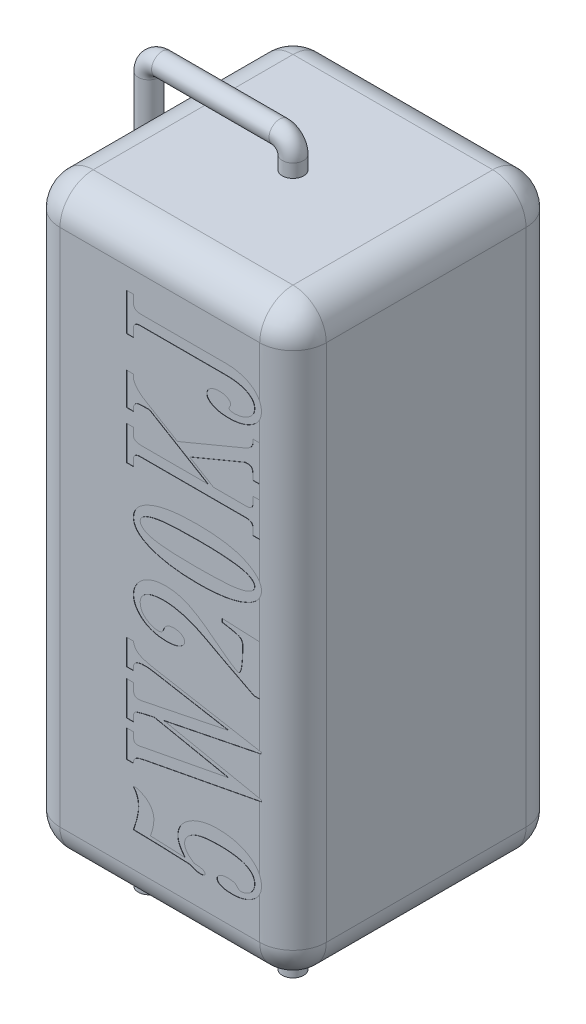
from build123d import *

# Parameters (mm, degrees)
BOSS_EXTRUDE1_DEPTH = 22
FILLET1_R           = 1.25
SKETCH2_R           = 0.4
BOSS_EXTRUDE2_DEPTH = 4
SWEEP2_PROFILE_R    = 0.4
CUT_EXTRUDE1_DEPTH  = 0.01


with BuildPart() as part:
    # Sketch1 → Boss-Extrude1 (new body)
    with BuildSketch(Plane(origin=(0, 0, 0), x_dir=(1, 0, 0), z_dir=(0, 1, 0))):
        with BuildLine():
            Line((-3.75, 5), (3.75, 5))
            ThreePointArc((3.75, 5), (4.633883476, 4.633883476), (5, 3.75))
            Line((5, 3.75), (5, -3.75))
            ThreePointArc((5, -3.75), (4.633883476, -4.633883476), (3.75, -5))
            Line((3.75, -5), (-3.75, -5))
            ThreePointArc((-3.75, -5), (-4.633883476, -4.633883476), (-5, -3.75))
            Line((-5, -3.75), (-5, 3.75))
            ThreePointArc((-5, 3.75), (-4.633883476, 4.633883476), (-3.75, 5))
        make_face()
    extrude(amount=BOSS_EXTRUDE1_DEPTH)

    # Fillet1
    fillet1_edges = [part.edges().sort_by_distance(p)[0] for p in [
        (-5, 0, 0),
        (-4.633883476, 0, -4.633883476),
        (0, 0, -5),
        (4.633883476, 0, -4.633883476),
        (-4.633883476, 22, -4.633883476),
        (-5, 22, 0),
        (-4.633883476, 22, 4.633883476),
        (0, 22, 5),
        (4.633883476, 22, 4.633883476),
        (5, 22, 0),
        (4.633883476, 22, -4.633883476),
        (5, 0, 0),
        (0, 22, -5),
        (4.633883476, 0, 4.633883476),
        (0, 0, 5),
        (-4.633883476, 0, 4.633883476),
    ]]
    fillet(fillet1_edges, radius=FILLET1_R)

    # Sketch2 → Boss-Extrude2 (add)
    with BuildSketch(Plane.XZ):
        with Locations(Location((0, 0, 0), (0, 0, 270))):
            Circle(SKETCH2_R)
    extrude(amount=BOSS_EXTRUDE2_DEPTH)

    # Sweep2: sweep along a path in Sketch3
    with BuildLine(Plane.XY) as sweep2_path:
        Line((0, 22), (0, 22.5))
        ThreePointArc((0, 22.5), (-0.146446609, 22.853553391), (-0.5, 23))
        Line((-0.5, 23), (-4.91, 23))
        ThreePointArc((-4.91, 23), (-5.263553391, 22.853553391), (-5.41, 22.5))
        Line((-5.41, 22.5), (-5.41, -4))
    # Sweep2 profile (on start of the path) → Sweep2 (sweep)
    with BuildSketch(Plane(origin=(0, 22, 0), x_dir=(1, 0, 0), z_dir=(0, 1, 0))):
        Circle(SWEEP2_PROFILE_R)
    sweep(path=sweep2_path.line)

    # Sketch28 → Cut-Extrude1 (cut)
    # profile 1 of 6: a face of its own
    with BuildSketch(Plane.XY.offset(5)):
        with BuildLine():
            add(Edge.make_bspline(
                [(-0.993589744, 2.542467949), (-0.978307234, 2.585114271), (-0.948598002, 2.668018817), (-0.909574789, 2.790296485), (-0.876337133, 2.906500732), (-0.849157251, 3.016729938), (-0.827912027, 3.120966271), (-0.81281788, 3.219223515), (-0.80319514, 3.311506386), (-0.801904352, 3.371106166), (-0.801282051, 3.399839744)],
                knots=[0, 0, 0, 0, 1.231547186, 2.394130472, 3.48882468, 4.516917581, 5.479964155, 6.37985664, 7.218914656, 8, 8, 8, 8], degree=3))
            add(Edge.make_bspline(
                [(-0.801282051, 3.399839744), (-0.803279711, 3.450533912), (-0.80719983, 3.55001388), (-0.840596315, 3.668503859), (-0.873522781, 3.755010231), (-0.901672878, 3.810632084), (-0.930291261, 3.858940951), (-0.952845176, 3.885867534), (-0.963541667, 3.898637821)],
                knots=[0, 0, 0, 0, 1.703203784, 3.34229095, 4.11486405, 4.818852633, 5.439825325, 6, 6, 6, 6], degree=3))
            add(Edge.make_bspline(
                [(-0.963541667, 3.898637821), (-0.971527113, 3.907921778), (-0.983436897, 3.921768208), (-0.991073457, 3.938271886), (-0.993589744, 3.943709936)],
                knots=[0, 0, 0, 0, 1.340989405, 2, 2, 2, 2], degree=3))
            add(Edge.make_bspline(
                [(-0.993589744, 3.943709936), (-0.990038681, 3.949827531), (-0.979858438, 3.967365548), (-0.958451202, 3.965777619), (-0.944511218, 3.96474359)],
                knots=[0, 0, 0, 0, 0.697638205, 2, 2, 2, 2], degree=3))
            add(Edge.make_bspline(
                [(-0.944511218, 3.96474359), (-0.92339519, 3.963334311), (-0.877919315, 3.960299263), (-0.80549498, 3.941839223), (-0.724983857, 3.910842365), (-0.636988641, 3.871270681), (-0.548833917, 3.821660682), (-0.466719566, 3.762983872), (-0.396373672, 3.693510812), (-0.334488512, 3.617728128), (-0.285478149, 3.533590036), (-0.249714387, 3.442852284), (-0.228190869, 3.345755858), (-0.225653021, 3.278755031), (-0.224358974, 3.244591346)],
                knots=[0, 0, 0, 0, 0.681915251, 1.46858554, 2.399324007, 3.464989181, 4.57964638, 5.659436258, 6.71100783, 7.761087771, 8.808953985, 9.839446264, 10.898334831, 12, 12, 12, 12], degree=3))
            add(Edge.make_bspline(
                [(-0.224358974, 3.244591346), (-0.226060808, 3.202091377), (-0.229649101, 3.112480794), (-0.255776537, 2.97278401), (-0.295588341, 2.82132393), (-0.332993779, 2.718473993), (-0.352564103, 2.664663462)],
                knots=[0, 0, 0, 0, 0.854149321, 1.800961732, 2.849475059, 4, 4, 4, 4], degree=3))
            Line((-0.352564103, 2.664663462), (0.94150641, 2.608573718))
            add(Edge.make_bspline(
                [(0.94150641, 2.608573718), (0.920172978, 2.634714444), (0.8791558, 2.684974467), (0.824393028, 2.761779436), (0.778453872, 2.836860231), (0.739502428, 2.910014736), (0.71080508, 2.982129191), (0.689233901, 3.052019345), (0.675375934, 3.11984192), (0.673827476, 3.164737202), (0.673076923, 3.186498397)],
                knots=[0, 0, 0, 0, 1.246200287, 2.396033463, 3.481142823, 4.496141588, 5.453453585, 6.342982665, 7.196826978, 8, 8, 8, 8], degree=3))
            add(Edge.make_bspline(
                [(0.673076923, 3.186498397), (0.674503246, 3.219978346), (0.677338756, 3.286536027), (0.697682377, 3.384202429), (0.732201558, 3.477664829), (0.781124984, 3.566242819), (0.842785919, 3.651252592), (0.918784394, 3.731259774), (1.00760823, 3.807876963), (1.109353541, 3.878898865), (1.220396438, 3.944475278), (1.339277064, 4.001893988), (1.464658015, 4.049877689), (1.596413881, 4.088635504), (1.734145216, 4.120099153), (1.878446755, 4.141684421), (2.029322661, 4.155112797), (2.132048728, 4.156396097), (2.184495192, 4.157051282)],
                knots=[0, 0, 0, 0, 0.811049684, 1.612355701, 2.405904379, 3.216913708, 4.056828013, 4.944042407, 5.884792743, 6.894931967, 7.946722818, 9.00697487, 10.090313102, 11.196166917, 12.332614944, 13.51119402, 14.729348082, 16, 16, 16, 16], degree=3))
            add(Edge.make_bspline(
                [(2.184495192, 4.157051282), (2.24260895, 4.15595206), (2.355978551, 4.153807673), (2.522303004, 4.141085525), (2.68052728, 4.11801748), (2.831111808, 4.086020617), (2.974089509, 4.045483226), (3.108451375, 3.993452347), (3.236351103, 3.935450594), (3.353935818, 3.86576182), (3.461631927, 3.791080266), (3.555922423, 3.709363855), (3.635640998, 3.622192771), (3.700749906, 3.52895287), (3.75121518, 3.430138874), (3.787355621, 3.326024498), (3.810573213, 3.216567251), (3.812912229, 3.141544679), (3.814102564, 3.103365385)],
                knots=[0, 0, 0, 0, 1.295980066, 2.528226489, 3.716948526, 4.858841566, 5.959229616, 7.026684942, 8.069263137, 9.08695521, 10.070157952, 10.988351946, 11.863268593, 12.697650082, 13.516745126, 14.329078957, 15.149661422, 16, 16, 16, 16], degree=3))
            add(Edge.make_bspline(
                [(3.814102564, 3.103365385), (3.813135046, 3.074265997), (3.811231087, 3.017001887), (3.796351618, 2.933192202), (3.769140289, 2.854348091), (3.734883734, 2.778404153), (3.687284448, 2.707933058), (3.631507256, 2.640494841), (3.564356281, 2.578298831), (3.48883981, 2.520663146), (3.405792594, 2.469457637), (3.31900772, 2.422631001), (3.226960888, 2.385209702), (3.131987614, 2.352292329), (3.032441766, 2.32926364), (2.929642475, 2.310249547), (2.822685742, 2.300928864), (2.750079454, 2.299035133), (2.713341346, 2.298076923)],
                knots=[0, 0, 0, 0, 0.922208343, 1.814795596, 2.684891448, 3.560760207, 4.447178154, 5.371266885, 6.329565094, 7.341300266, 8.377804243, 9.419266565, 10.462877342, 11.523730255, 12.601757306, 13.697864764, 14.835140938, 16, 16, 16, 16], degree=3))
            add(Edge.make_bspline(
                [(2.713341346, 2.298076923), (2.670562602, 2.298688471), (2.59015659, 2.299837925), (2.47738574, 2.312282479), (2.379443818, 2.329685427), (2.298080817, 2.357737737), (2.232584757, 2.390974668), (2.184986212, 2.430183979), (2.152533271, 2.475169164), (2.149106781, 2.508962047), (2.147435897, 2.525440705)],
                knots=[0, 0, 0, 0, 1.556571391, 2.925698296, 4.127117036, 5.168817889, 6.049683142, 6.782708115, 7.406403527, 8, 8, 8, 8], degree=3))
            add(Edge.make_bspline(
                [(2.147435897, 2.525440705), (2.148684184, 2.541091541), (2.151204459, 2.572690395), (2.175862719, 2.616317949), (2.213056885, 2.654969837), (2.264134159, 2.687487693), (2.326432036, 2.714008684), (2.398129805, 2.733877717), (2.478985599, 2.744504739), (2.535359904, 2.746003889), (2.565104167, 2.746794872)],
                knots=[0, 0, 0, 0, 0.719439318, 1.452539576, 2.261897271, 3.188197876, 4.233798465, 5.389213258, 6.622494287, 8, 8, 8, 8], degree=3))
            add(Edge.make_bspline(
                [(2.565104167, 2.746794872), (2.587130971, 2.746184923), (2.62888455, 2.745028716), (2.687713584, 2.742527462), (2.738362209, 2.732455911), (2.795623239, 2.719231612), (2.859741459, 2.687302736), (2.896172336, 2.645710316), (2.914663462, 2.624599359)],
                knots=[0, 0, 0, 0, 1.029730522, 1.951936976, 2.744209041, 3.436380128, 4.698790125, 6, 6, 6, 6], degree=3))
            add(Edge.make_bspline(
                [(2.914663462, 2.624599359), (2.923884182, 2.613736814), (2.941059201, 2.593503643), (2.973000922, 2.571852582), (3.006091209, 2.5562706), (3.030011176, 2.555078191), (3.041866987, 2.554487179)],
                knots=[0, 0, 0, 0, 1.130910796, 2.106496316, 3.061494445, 4, 4, 4, 4], degree=3))
            add(Edge.make_bspline(
                [(3.041866987, 2.554487179), (3.059594708, 2.555476674), (3.09629595, 2.557525199), (3.152914288, 2.56766449), (3.21178108, 2.586186565), (3.27227746, 2.610925064), (3.332230892, 2.642163023), (3.386998376, 2.682230269), (3.436171145, 2.729378182), (3.479028868, 2.783016923), (3.51391923, 2.842693832), (3.53959278, 2.907074143), (3.554931377, 2.975775266), (3.556761079, 3.023159427), (3.557692308, 3.047275641)],
                knots=[0, 0, 0, 0, 0.809181895, 1.675228348, 2.614333584, 3.617982435, 4.653233876, 5.688597255, 6.700754681, 7.751671599, 8.809184294, 9.841071972, 10.901211489, 12, 12, 12, 12], degree=3))
            add(Edge.make_bspline(
                [(3.557692308, 3.047275641), (3.556773324, 3.070730605), (3.554968031, 3.116806568), (3.539388004, 3.183777171), (3.514106279, 3.246648338), (3.47877338, 3.305308233), (3.432682301, 3.358925572), (3.376918557, 3.408152625), (3.311461468, 3.453392539), (3.235224805, 3.493306588), (3.148306263, 3.529787088), (3.048894709, 3.560265695), (2.936990803, 3.585836709), (2.812762527, 3.608271072), (2.675498961, 3.623259069), (2.52620032, 3.635156314), (2.364547672, 3.643759024), (2.252616169, 3.644069564), (2.194511218, 3.644230769)],
                knots=[0, 0, 0, 0, 0.684986288, 1.345617223, 1.998122364, 2.659329892, 3.337958374, 4.05694143, 4.828588602, 5.658243891, 6.56823808, 7.580808542, 8.693565504, 9.922787582, 11.269085249, 12.728131099, 14.301534632, 16, 16, 16, 16], degree=3))
            add(Edge.make_bspline(
                [(2.194511218, 3.644230769), (2.141420894, 3.643504744), (2.039200187, 3.642106848), (1.891124543, 3.635638345), (1.754420764, 3.622704611), (1.628437884, 3.604579594), (1.513329919, 3.582631167), (1.409708139, 3.552616601), (1.316006597, 3.521103758), (1.234693377, 3.480977047), (1.162492915, 3.439163032), (1.100676648, 3.393104253), (1.047563184, 3.345050753), (1.004897503, 3.293301015), (0.971687539, 3.238938518), (0.946633626, 3.181904597), (0.932651733, 3.121394144), (0.930545374, 3.08006024), (0.929487179, 3.059294872)],
                knots=[0, 0, 0, 0, 1.665745363, 3.207244809, 4.648700358, 5.971520891, 7.199946066, 8.320768827, 9.354408294, 10.296067206, 11.160135886, 11.96877981, 12.71003263, 13.402064862, 14.06494569, 14.703118331, 15.348471282, 16, 16, 16, 16], degree=3))
            add(Edge.make_bspline(
                [(0.929487179, 3.059294872), (0.93087623, 3.039846809), (0.933721543, 3.000009629), (0.950000513, 2.940313968), (0.979199728, 2.881651763), (1.018814351, 2.823237315), (1.06954963, 2.765105061), (1.131206806, 2.706721884), (1.204446012, 2.649156302), (1.258116021, 2.61258791), (1.286057692, 2.593549679)],
                knots=[0, 0, 0, 0, 0.765994807, 1.569054661, 2.415123578, 3.333284174, 4.339250278, 5.444998613, 6.669815615, 8, 8, 8, 8], degree=3))
            add(Edge.make_bspline(
                [(1.286057692, 2.593549679), (1.323816756, 2.591260349), (1.392459372, 2.587098549), (1.485119558, 2.576323489), (1.557753659, 2.563287013), (1.611739934, 2.546533372), (1.65054013, 2.526771543), (1.677647967, 2.504619103), (1.695806737, 2.478827293), (1.697773039, 2.459573132), (1.698717949, 2.450320513)],
                knots=[0, 0, 0, 0, 1.945184355, 3.536172049, 4.795641994, 5.735040855, 6.434009872, 7.018834516, 7.528499298, 8, 8, 8, 8], degree=3))
            add(Edge.make_bspline(
                [(1.698717949, 2.450320513), (1.696086678, 2.43740611), (1.69018244, 2.408427818), (1.644182174, 2.381773629), (1.584815721, 2.364407212), (1.537739752, 2.362978384), (1.511418269, 2.362179487)],
                knots=[0, 0, 0, 0, 0.674426984, 1.513329092, 2.609633153, 4, 4, 4, 4], degree=3))
            add(Edge.make_bspline(
                [(1.511418269, 2.362179487), (1.485651119, 2.363240965), (1.43374942, 2.365379057), (1.356326124, 2.37980616), (1.27921046, 2.40388878), (1.230046675, 2.42732754), (1.204927885, 2.439302885)],
                knots=[0, 0, 0, 0, 0.969426889, 1.952676295, 2.953980157, 4, 4, 4, 4], degree=3))
            add(Edge.make_bspline(
                [(1.204927885, 2.439302885), (1.190773171, 2.446499032), (1.164724357, 2.459742047), (1.136627384, 2.467714074), (1.123798077, 2.471354167)],
                knots=[0, 0, 0, 0, 1.08678372, 2, 2, 2, 2], degree=3))
            Line((1.123798077, 2.471354167), (0.11318109, 2.515424679))
            add(Edge.make_bspline(
                [(0.11318109, 2.515424679), (0.017034833, 2.519327665), (-0.172556963, 2.527024003), (-0.453374049, 2.534438451), (-0.726129099, 2.541377869), (-0.905444313, 2.542108697), (-0.993589744, 2.542467949)],
                knots=[0, 0, 0, 0, 1.042918682, 2.056542097, 3.044660353, 4, 4, 4, 4], degree=3))
        make_face()
    # profile 2 of 6: a face of its own
    with BuildSketch(Plane.XY.offset(5)):
        with BuildLine():
            Line((-1.25, 4.701923077), (-1.25, 5.727564103))
            Line((-1.25, 5.727564103), (-0.993589744, 5.727564103))
            Line((-0.993589744, 5.727564103), (-0.993589744, 5.647435897))
            add(Edge.make_bspline(
                [(-0.993589744, 5.647435897), (-0.992875579, 5.620399847), (-0.991585402, 5.571557706), (-0.986087023, 5.506033698), (-0.973388718, 5.457089758), (-0.956722599, 5.421047322), (-0.930637346, 5.399516922), (-0.900852002, 5.385809081), (-0.865946797, 5.376298665), (-0.840749368, 5.375451425), (-0.827323718, 5.375)],
                knots=[0, 0, 0, 0, 1.750842369, 3.162994943, 4.237173358, 5.019875867, 5.678249182, 6.373839841, 7.133552237, 8, 8, 8, 8], degree=3))
            add(Edge.make_bspline(
                [(-0.827323718, 5.375), (-0.815953195, 5.375469453), (-0.790088043, 5.376537343), (-0.747101149, 5.383507312), (-0.695183024, 5.391989845), (-0.658010366, 5.400481633), (-0.638020833, 5.405048077)],
                knots=[0, 0, 0, 0, 0.710888309, 1.617096649, 2.718597856, 4, 4, 4, 4], degree=3))
            Line((-0.638020833, 5.405048077), (-0.574919872, 5.417067308))
            Line((-0.574919872, 5.417067308), (2.569110577, 6.016025641))
            Line((2.569110577, 6.016025641), (-0.214342949, 6.586939103))
            add(Edge.make_bspline(
                [(-0.214342949, 6.586939103), (-0.260410335, 6.576896574), (-0.347555944, 6.557899136), (-0.470641202, 6.531489449), (-0.578237286, 6.505726894), (-0.671006066, 6.484508981), (-0.748707134, 6.464081157), (-0.811432466, 6.446884192), (-0.858696733, 6.430566492), (-0.901430322, 6.4145847), (-0.940722966, 6.388143391), (-0.971299092, 6.343163347), (-0.991422921, 6.287745691), (-0.99282934, 6.246603295), (-0.993589744, 6.224358974)],
                knots=[0, 0, 0, 0, 1.825209223, 3.452745691, 4.872888789, 6.108020439, 7.136212082, 7.983024009, 8.624698808, 9.071101437, 9.748733414, 10.415806828, 11.143479647, 12, 12, 12, 12], degree=3))
            Line((-0.993589744, 6.224358974), (-0.993589744, 6.048076923))
            Line((-0.993589744, 6.048076923), (-1.25, 6.048076923))
            Line((-1.25, 6.048076923), (-1.25, 7.330128205))
            Line((-1.25, 7.330128205), (-0.993589744, 7.330128205))
            Line((-0.993589744, 7.330128205), (-0.993589744, 7.183894231))
            add(Edge.make_bspline(
                [(-0.993589744, 7.183894231), (-0.993034103, 7.154503699), (-0.992033856, 7.101595814), (-0.984820157, 7.030201315), (-0.971683038, 6.975682135), (-0.95299222, 6.934785671), (-0.92481765, 6.909246753), (-0.893666812, 6.89061439), (-0.855900888, 6.880881711), (-0.829373153, 6.879263597), (-0.815304487, 6.878405449)],
                knots=[0, 0, 0, 0, 1.735250379, 3.123741614, 4.223119635, 5.042810901, 5.725776391, 6.432222146, 7.168547857, 8, 8, 8, 8], degree=3))
            add(Edge.make_bspline(
                [(-0.815304487, 6.878405449), (-0.792881117, 6.878834427), (-0.74951127, 6.879664128), (-0.706750207, 6.886920194), (-0.686097756, 6.890424679)],
                knots=[0, 0, 0, 0, 1.034053453, 2, 2, 2, 2], degree=3))
            Line((-0.686097756, 6.890424679), (2.564102564, 7.554487179))
            Line((2.564102564, 7.554487179), (-0.247395833, 8.056290064))
            add(Edge.make_bspline(
                [(-0.247395833, 8.056290064), (-0.30068814, 8.065307242), (-0.404475474, 8.082868291), (-0.509702139, 8.085202495), (-0.560897436, 8.086338141)],
                knots=[0, 0, 0, 0, 1.026952026, 2, 2, 2, 2], degree=3))
            add(Edge.make_bspline(
                [(-0.560897436, 8.086338141), (-0.595669636, 8.085791104), (-0.660492365, 8.084771311), (-0.75028718, 8.071868176), (-0.825766515, 8.05141798), (-0.887496264, 8.022662429), (-0.935854341, 7.984656833), (-0.970424836, 7.936988254), (-0.989500916, 7.879682544), (-0.992188496, 7.839078659), (-0.993589744, 7.817908654)],
                knots=[0, 0, 0, 0, 1.448510443, 2.70032952, 3.770906966, 4.698393667, 5.520009304, 6.307927848, 7.117789401, 8, 8, 8, 8], degree=3))
            Line((-0.993589744, 7.817908654), (-0.993589744, 7.71474359))
            Line((-0.993589744, 7.71474359), (-1.25, 7.71474359))
            Line((-1.25, 7.71474359), (-1.25, 8.676282051))
            Line((-1.25, 8.676282051), (-0.993589744, 8.676282051))
            add(Edge.make_bspline(
                [(-0.993589744, 8.676282051), (-0.988774618, 8.65410162), (-0.979428371, 8.61104899), (-0.95732769, 8.551230082), (-0.930310952, 8.497994043), (-0.89641422, 8.451707712), (-0.855233052, 8.41136411), (-0.807711224, 8.373788242), (-0.751809402, 8.340127938), (-0.686812552, 8.306506223), (-0.605988379, 8.276529921), (-0.50580571, 8.246878024), (-0.384184525, 8.21607393), (-0.295219433, 8.197489921), (-0.247395833, 8.1875)],
                knots=[0, 0, 0, 0, 0.851438132, 1.652657268, 2.387247837, 3.086876754, 3.796100774, 4.546044394, 5.356722662, 6.242631899, 7.290388877, 8.587331099, 10.165503952, 12, 12, 12, 12], degree=3))
            Line((-0.247395833, 8.1875), (3.814102564, 7.462339744))
            Line((3.814102564, 7.462339744), (3.814102564, 7.398237179))
            Line((3.814102564, 7.398237179), (0.159254808, 6.663060897))
            Line((0.159254808, 6.663060897), (3.814102564, 5.913862179))
            Line((3.814102564, 5.913862179), (3.814102564, 5.848758013))
            Line((3.814102564, 5.848758013), (-0.574919872, 5.014423077))
            add(Edge.make_bspline(
                [(-0.574919872, 5.014423077), (-0.614072815, 5.006168533), (-0.685488625, 4.991112067), (-0.781337215, 4.964865904), (-0.855472334, 4.936324329), (-0.911447578, 4.905622776), (-0.949522457, 4.865928939), (-0.976321539, 4.81980013), (-0.991206599, 4.763564359), (-0.992760257, 4.723378172), (-0.993589744, 4.701923077)],
                knots=[0, 0, 0, 0, 1.652802471, 3.014747296, 4.097952456, 4.932796067, 5.625192084, 6.341880575, 7.114742845, 8, 8, 8, 8], degree=3))
            Line((-0.993589744, 4.701923077), (-1.25, 4.701923077))
        make_face()
    # profile 3 of 6: a face of its own
    with BuildSketch(Plane.XY.offset(5)):
        with BuildLine():
            add(Edge.make_bspline(
                [(2.915665064, 9.637820513), (2.923200599, 9.634357289), (2.937572049, 9.627752376), (2.961489762, 9.630814489), (2.983695649, 9.640920621), (3.001483705, 9.662350756), (3.020264143, 9.689509941), (3.035207835, 9.726967886), (3.049246824, 9.77288751), (3.062035569, 9.827437218), (3.072617994, 9.891063659), (3.082930155, 9.963145723), (3.090270994, 10.044081296), (3.097788123, 10.133850183), (3.102119731, 10.232419571), (3.106572457, 10.339907801), (3.10813608, 10.456126211), (3.108688072, 10.536592195), (3.108974359, 10.578325321)],
                knots=[0, 0, 0, 0, 0.379450938, 0.723672599, 1.086104917, 1.493929659, 1.999570879, 2.627708734, 3.362057828, 4.242692419, 5.239221412, 6.371907819, 7.64020558, 9.03130268, 10.575904934, 12.24436307, 14.052164869, 16, 16, 16, 16], degree=3))
            add(Edge.make_bspline(
                [(3.108974359, 10.578325321), (3.107826819, 10.602525111), (3.105635675, 10.648732865), (3.083676139, 10.712931963), (3.044081784, 10.764583561), (2.998945269, 10.798122304), (2.951554746, 10.819796612), (2.902450403, 10.836590396), (2.840505723, 10.854182662), (2.765456313, 10.873369549), (2.677389046, 10.891677324), (2.576728517, 10.912303799), (2.462688122, 10.931722444), (2.382150862, 10.94495527), (2.33974359, 10.951923077)],
                knots=[0, 0, 0, 0, 0.929749632, 1.775289858, 2.56444306, 3.399861398, 3.911549456, 4.566022714, 5.39578655, 6.390181715, 7.54727176, 8.857983886, 10.345556647, 12, 12, 12, 12], degree=3))
            Line((2.33974359, 10.951923077), (2.33974359, 11.080128205))
            Line((2.33974359, 11.080128205), (3.75, 11.020032051))
            Line((3.75, 11.020032051), (3.75, 9.157051282))
            Line((3.75, 9.157051282), (3.533653846, 9.157051282))
            Line((3.533653846, 9.157051282), (2.427884615, 9.728966346))
            add(Edge.make_bspline(
                [(2.427884615, 9.728966346), (2.357837283, 9.767147288), (2.224969774, 9.839569842), (2.034977155, 9.940743952), (1.866069378, 10.030599244), (1.717897083, 10.109824992), (1.588730357, 10.173729536), (1.481455847, 10.228598025), (1.394479062, 10.271088162), (1.34253885, 10.293995375), (1.320112179, 10.303886218)],
                knots=[0, 0, 0, 0, 1.533767548, 2.909288151, 4.138307885, 5.212155446, 6.139361597, 6.908686017, 7.528794019, 8, 8, 8, 8], degree=3))
            add(Edge.make_bspline(
                [(1.320112179, 10.303886218), (1.266527473, 10.325682136), (1.161491842, 10.368406043), (1.00337894, 10.42425654), (0.847651325, 10.468855717), (0.695469213, 10.504715932), (0.548863588, 10.533291056), (0.407984862, 10.551782743), (0.274016559, 10.564873179), (0.186660851, 10.566511792), (0.144230769, 10.567307692)],
                knots=[0, 0, 0, 0, 1.144819283, 2.244051026, 3.316889239, 4.349052047, 5.337854268, 6.271419009, 7.160400217, 8, 8, 8, 8], degree=3))
            add(Edge.make_bspline(
                [(0.144230769, 10.567307692), (0.079362209, 10.566068977), (-0.043573668, 10.563721422), (-0.217274762, 10.538381783), (-0.369668897, 10.498738181), (-0.480716171, 10.450038945), (-0.556633609, 10.403723211), (-0.604914507, 10.365869774), (-0.645058367, 10.324318781), (-0.679476731, 10.280628287), (-0.705171447, 10.232737267), (-0.723396116, 10.181718956), (-0.734854606, 10.127775029), (-0.736390673, 10.09060322), (-0.737179487, 10.071514423)],
                knots=[0, 0, 0, 0, 2.07862581, 3.939314916, 5.614369977, 7.114396622, 7.806619143, 8.462017625, 9.075226957, 9.655498852, 10.239903649, 10.808806339, 11.388287672, 12, 12, 12, 12], degree=3))
            add(Edge.make_bspline(
                [(-0.737179487, 10.071514423), (-0.736847455, 10.050076315), (-0.736194204, 10.007898215), (-0.723742609, 9.946799171), (-0.708875178, 9.887677047), (-0.683812143, 9.832750078), (-0.654107279, 9.779539491), (-0.615244871, 9.731308945), (-0.572098209, 9.68390458), (-0.504562131, 9.628443279), (-0.414037729, 9.568843316), (-0.299318738, 9.516242297), (-0.180803658, 9.483005364), (-0.100370466, 9.479379591), (-0.060096154, 9.477564103)],
                knots=[0, 0, 0, 0, 0.772550065, 1.519942562, 2.245420714, 2.968992482, 3.692865592, 4.44054983, 5.199811802, 6.004171048, 7.58940068, 9.100245567, 10.548042, 12, 12, 12, 12], degree=3))
            add(Edge.make_bspline(
                [(-0.060096154, 9.477564103), (-0.035238962, 9.478346428), (0.009041964, 9.479740071), (0.048706851, 9.499113894), (0.066105769, 9.507612179)],
                knots=[0, 0, 0, 0, 1.122704254, 2, 2, 2, 2], degree=3))
            add(Edge.make_bspline(
                [(0.066105769, 9.507612179), (0.073386046, 9.513346974), (0.089300548, 9.525883088), (0.109029973, 9.552842278), (0.126715051, 9.587699626), (0.137418245, 9.613692547), (0.143229167, 9.627804487)],
                knots=[0, 0, 0, 0, 0.764967343, 1.672199246, 2.736202695, 4, 4, 4, 4], degree=3))
            add(Edge.make_bspline(
                [(0.143229167, 9.627804487), (0.150151757, 9.646545516), (0.163612266, 9.682986182), (0.196280373, 9.730640031), (0.234108467, 9.772780466), (0.280997151, 9.805651577), (0.334488545, 9.83126918), (0.395063849, 9.8488119), (0.463000257, 9.859995501), (0.510768905, 9.861427428), (0.535857372, 9.862179487)],
                knots=[0, 0, 0, 0, 0.969799167, 1.88570901, 2.795094678, 3.716046926, 4.654645721, 5.673677187, 6.778197119, 8, 8, 8, 8], degree=3))
            add(Edge.make_bspline(
                [(0.535857372, 9.862179487), (0.562986613, 9.861687144), (0.615309549, 9.860737585), (0.689830837, 9.84570941), (0.758123899, 9.824810409), (0.816617924, 9.792169196), (0.866421567, 9.755277014), (0.90287826, 9.711150679), (0.925669651, 9.661189117), (0.928206143, 9.625697307), (0.929487179, 9.607772436)],
                knots=[0, 0, 0, 0, 1.254051346, 2.418631833, 3.509094062, 4.546978011, 5.505825576, 6.363166055, 7.173329367, 8, 8, 8, 8], degree=3))
            add(Edge.make_bspline(
                [(0.929487179, 9.607772436), (0.926946027, 9.586614328), (0.92164443, 9.542472241), (0.882512437, 9.481363712), (0.821249719, 9.426944485), (0.739608224, 9.376947857), (0.639109611, 9.33602188), (0.522941569, 9.30601659), (0.392834998, 9.288377945), (0.301205106, 9.286326544), (0.253405449, 9.28525641)],
                knots=[0, 0, 0, 0, 0.624329939, 1.302537376, 2.085996619, 3.040683614, 4.122099981, 5.287517358, 6.58500609, 8, 8, 8, 8], degree=3))
            add(Edge.make_bspline(
                [(0.253405449, 9.28525641), (0.198260594, 9.286654123), (0.089936826, 9.289399719), (-0.068776346, 9.309476535), (-0.219609694, 9.343712793), (-0.362268373, 9.390325889), (-0.494939336, 9.450917789), (-0.615089952, 9.526914277), (-0.723443549, 9.615731099), (-0.817975682, 9.716748243), (-0.894995132, 9.827405599), (-0.952738044, 9.943722444), (-0.987105498, 10.06556777), (-0.991433938, 10.148432323), (-0.993589744, 10.189703526)],
                knots=[0, 0, 0, 0, 1.163876679, 2.286260559, 3.37019547, 4.42432665, 5.449120223, 6.440434933, 7.416781447, 8.399112272, 9.351171535, 10.252612874, 11.129703033, 12, 12, 12, 12], degree=3))
            add(Edge.make_bspline(
                [(-0.993589744, 10.189703526), (-0.991413283, 10.230644377), (-0.987064499, 10.312448244), (-0.953441634, 10.432187363), (-0.899236062, 10.546952443), (-0.825033928, 10.655615885), (-0.73308356, 10.754852591), (-0.627282378, 10.842896559), (-0.507600573, 10.916324607), (-0.376111358, 10.975863804), (-0.235106173, 11.022892652), (-0.08630997, 11.055365118), (0.068530558, 11.076068481), (0.173878376, 11.078761136), (0.227363782, 11.080128205)],
                knots=[0, 0, 0, 0, 0.879093927, 1.756516544, 2.652238314, 3.597723246, 4.572892894, 5.551489474, 6.54727655, 7.581326253, 8.647959553, 9.736175534, 10.850649474, 12, 12, 12, 12], degree=3))
            add(Edge.make_bspline(
                [(0.227363782, 11.080128205), (0.303664118, 11.077325021), (0.458000483, 11.071654885), (0.648961116, 11.035714032), (0.80018752, 10.996142056), (0.911480472, 10.960370512), (1.018849099, 10.917349841), (1.087605066, 10.883579569), (1.121794872, 10.866786859)],
                knots=[0, 0, 0, 0, 1.480093479, 2.993856361, 3.757660505, 4.513758048, 5.260946708, 6, 6, 6, 6], degree=3))
            add(Edge.make_bspline(
                [(1.121794872, 10.866786859), (1.178408891, 10.836757141), (1.288291892, 10.77847201), (1.445509381, 10.68760436), (1.588459152, 10.593577419), (1.677614647, 10.527948808), (1.720753205, 10.49619391)],
                knots=[0, 0, 0, 0, 1.090432479, 2.116436792, 3.088623757, 4, 4, 4, 4], degree=3))
            Line((1.720753205, 10.49619391), (2.447916667, 9.943309295))
            add(Edge.make_bspline(
                [(2.447916667, 9.943309295), (2.49178882, 9.910647571), (2.575331929, 9.848451811), (2.696941478, 9.764465403), (2.808369823, 9.693885354), (2.881361763, 9.655744972), (2.915665064, 9.637820513)],
                knots=[0, 0, 0, 0, 1.17317505, 2.234006813, 3.170053611, 4, 4, 4, 4], degree=3))
        make_face()
    # profile 4 of 6: a face of its own
    with BuildSketch(Plane.XY.offset(5)):
        with BuildLine():
            add(Edge.make_bspline(
                [(-0.993589744, 12.699719551), (-0.992144965, 12.731945874), (-0.989288721, 12.795655485), (-0.963345946, 12.888475728), (-0.924453015, 12.978017484), (-0.867121899, 13.062157497), (-0.794951238, 13.142269676), (-0.706463989, 13.216824228), (-0.604160019, 13.29019239), (-0.527057461, 13.331293222), (-0.486778846, 13.352764423)],
                knots=[0, 0, 0, 0, 0.885662177, 1.750903858, 2.635849963, 3.564012034, 4.54054556, 5.596590378, 6.7444514, 8, 8, 8, 8], degree=3))
            add(Edge.make_bspline(
                [(-0.486778846, 13.352764423), (-0.431832858, 13.379281295), (-0.317589058, 13.434415223), (-0.129452564, 13.497395682), (0.076949727, 13.554215882), (0.304198112, 13.597853114), (0.55072426, 13.634404583), (0.817918987, 13.658424988), (1.104921147, 13.673663498), (1.303063714, 13.675391103), (1.405248397, 13.676282051)],
                knots=[0, 0, 0, 0, 0.755696782, 1.571246132, 2.454866932, 3.408690911, 4.437780737, 5.543661237, 6.733234341, 8, 8, 8, 8], degree=3))
            add(Edge.make_bspline(
                [(1.405248397, 13.676282051), (1.500420691, 13.675745363), (1.685201538, 13.67470336), (1.953451658, 13.660059002), (2.20434149, 13.63822825), (2.437606546, 13.609472415), (2.653027702, 13.568656766), (2.851352692, 13.521580499), (3.032370407, 13.464922944), (3.194717585, 13.398614357), (3.339087894, 13.326973974), (3.464710718, 13.250881577), (3.572313534, 13.172401819), (3.659662984, 13.088301802), (3.72903277, 13.001308697), (3.778624056, 12.909623404), (3.807792825, 12.813650734), (3.81200339, 12.748317187), (3.814102564, 12.715745192)],
                knots=[0, 0, 0, 0, 1.63369818, 3.171890907, 4.610355956, 5.956868667, 7.204697569, 8.372448169, 9.454649019, 10.457288746, 11.380076226, 12.218572677, 12.976308183, 13.661361411, 14.294267803, 14.878902205, 15.441077467, 16, 16, 16, 16], degree=3))
            add(Edge.make_bspline(
                [(3.814102564, 12.715745192), (3.812577982, 12.684211731), (3.809548126, 12.621544163), (3.784493749, 12.529710008), (3.74268044, 12.443069776), (3.684865696, 12.360283625), (3.611578208, 12.281642087), (3.521953814, 12.206926244), (3.416264718, 12.136845735), (3.338087074, 12.096027882), (3.297275641, 12.074719551)],
                knots=[0, 0, 0, 0, 0.869694153, 1.728374097, 2.606673757, 3.514473897, 4.506077798, 5.566032424, 6.729384764, 8, 8, 8, 8], degree=3))
            add(Edge.make_bspline(
                [(3.297275641, 12.074719551), (3.240607992, 12.048625948), (3.122997696, 11.994470244), (2.931803366, 11.931495261), (2.72383073, 11.874413128), (2.497338016, 11.830599856), (2.253003114, 11.79546548), (1.990921098, 11.771114959), (1.710586801, 11.755817045), (1.517782889, 11.754094303), (1.418269231, 11.753205128)],
                knots=[0, 0, 0, 0, 0.778604098, 1.615945973, 2.510123432, 3.470998605, 4.494717288, 5.592168144, 6.757223567, 8, 8, 8, 8], degree=3))
            add(Edge.make_bspline(
                [(1.418269231, 11.753205128), (1.323435064, 11.754216657), (1.138667943, 11.756187438), (0.868982496, 11.770011288), (0.614053744, 11.794100427), (0.374030794, 11.826692112), (0.148554592, 11.868483792), (-0.06161453, 11.920154541), (-0.25719751, 11.981810672), (-0.379915613, 12.03216044), (-0.439703526, 12.056690705)],
                knots=[0, 0, 0, 0, 1.200900677, 2.33973648, 3.418398187, 4.442633649, 5.406179589, 6.320846438, 7.181921134, 8, 8, 8, 8], degree=3))
            add(Edge.make_bspline(
                [(-0.439703526, 12.056690705), (-0.483546785, 12.076865314), (-0.567156041, 12.115338368), (-0.680230915, 12.18399122), (-0.776420295, 12.257060183), (-0.855889903, 12.335191351), (-0.916881645, 12.419329641), (-0.961239902, 12.508109384), (-0.988227251, 12.602339725), (-0.991797028, 12.667164859), (-0.993589744, 12.699719551)],
                knots=[0, 0, 0, 0, 1.285455975, 2.451369231, 3.517456749, 4.499014797, 5.410340104, 6.273886609, 7.133158901, 8, 8, 8, 8], degree=3))
        make_face()
        with BuildLine():
            add(Edge.make_bspline(
                [(-0.737179487, 12.710737179), (-0.735679046, 12.693546152), (-0.732673923, 12.659115512), (-0.712525094, 12.60908723), (-0.678038922, 12.563893162), (-0.631523207, 12.521084044), (-0.572121353, 12.481255326), (-0.499053821, 12.446129166), (-0.414305616, 12.411655631), (-0.314036124, 12.38004693), (-0.192415966, 12.353082786), (-0.045587819, 12.329654929), (0.129608572, 12.310339656), (0.33232385, 12.293419559), (0.563120915, 12.280799274), (0.821587286, 12.271992591), (1.108089216, 12.267331044), (1.308425293, 12.266474087), (1.413261218, 12.266025641)],
                knots=[0, 0, 0, 0, 0.357631215, 0.716273165, 1.103951726, 1.531588243, 2.026795588, 2.58603785, 3.215597596, 3.929678191, 4.770638997, 5.805405109, 7.0221845, 8.437411364, 10.037827542, 11.831306423, 13.818521494, 16, 16, 16, 16], degree=3))
            add(Edge.make_bspline(
                [(1.413261218, 12.266025641), (1.515762639, 12.266345863), (1.712103974, 12.266959249), (1.993237949, 12.273316173), (2.248045161, 12.281765768), (2.475836879, 12.294439014), (2.676932261, 12.311227114), (2.85113028, 12.331530376), (2.998848707, 12.356420949), (3.122613139, 12.383858412), (3.225478407, 12.417118401), (3.313386286, 12.450335868), (3.387506671, 12.487746346), (3.448829109, 12.527108629), (3.497230345, 12.569178186), (3.53170079, 12.614311234), (3.553451077, 12.662842293), (3.556284057, 12.69684134), (3.557692308, 12.713741987)],
                knots=[0, 0, 0, 0, 2.141626734, 4.102283117, 5.875257101, 7.468330683, 8.868528617, 10.091131983, 11.131303575, 11.997684286, 12.736760735, 13.38835748, 13.959268939, 14.468122499, 14.907821492, 15.291492407, 15.647806687, 16, 16, 16, 16], degree=3))
            add(Edge.make_bspline(
                [(3.557692308, 12.713741987), (3.556637603, 12.73063211), (3.554521148, 12.764525201), (3.533716325, 12.812827904), (3.501799019, 12.857589561), (3.457490037, 12.89924255), (3.400321277, 12.936619527), (3.332206283, 12.972866341), (3.251057063, 13.00469872), (3.192258986, 13.02204511), (3.161057692, 13.03125)],
                knots=[0, 0, 0, 0, 0.742633435, 1.490228516, 2.28396094, 3.160128615, 4.158133375, 5.292780265, 6.563409534, 8, 8, 8, 8], degree=3))
            add(Edge.make_bspline(
                [(3.161057692, 13.03125), (3.117770953, 13.04212891), (3.023843829, 13.065734863), (2.868845151, 13.091901771), (2.689574247, 13.112864945), (2.486260194, 13.132437849), (2.258370359, 13.145262793), (2.006314603, 13.156875198), (1.729457243, 13.162316168), (1.536793485, 13.163068904), (1.436298077, 13.163461538)],
                knots=[0, 0, 0, 0, 0.617665032, 1.340260362, 2.173766462, 3.116068525, 4.167183877, 5.332956971, 6.608842786, 8, 8, 8, 8], degree=3))
            add(Edge.make_bspline(
                [(1.436298077, 13.163461538), (1.332793921, 13.163160842), (1.134781219, 13.162585582), (0.850991658, 13.155983489), (0.594113556, 13.148275958), (0.363781982, 13.133397955), (0.160153589, 13.11794708), (-0.016781377, 13.095335167), (-0.167185326, 13.07167313), (-0.292865983, 13.042178097), (-0.398189944, 13.009727594), (-0.487608167, 12.974883629), (-0.563214975, 12.938071068), (-0.6260926, 12.899267002), (-0.674501047, 12.855873399), (-0.711138716, 12.810974439), (-0.732884198, 12.761593627), (-0.735753287, 12.727623467), (-0.737179487, 12.710737179)],
                knots=[0, 0, 0, 0, 2.135476574, 4.085357544, 5.856784874, 7.43719442, 8.847317438, 10.069126772, 11.116653108, 11.987168667, 12.730136384, 13.38891528, 13.965000712, 14.46373886, 14.907659201, 15.300363594, 15.652216481, 16, 16, 16, 16], degree=3))
        make_face(mode=Mode.SUBTRACT)
    # profile 5 of 6: a face of its own
    with BuildSketch(Plane.XY.offset(5)):
        with BuildLine():
            Line((-1.25, 14.349358974), (-1.25, 15.631410256))
            Line((-1.25, 15.631410256), (-0.993589744, 15.631410256))
            Line((-0.993589744, 15.631410256), (-0.993589744, 15.361979167))
            add(Edge.make_bspline(
                [(-0.993589744, 15.361979167), (-0.992937501, 15.348042321), (-0.991670813, 15.320976287), (-0.972348976, 15.284287785), (-0.944644861, 15.252192306), (-0.905844131, 15.226857735), (-0.85935291, 15.206867041), (-0.806486366, 15.193819605), (-0.748218004, 15.184022819), (-0.707513586, 15.183150999), (-0.686097756, 15.182692308)],
                knots=[0, 0, 0, 0, 0.838397351, 1.628208613, 2.462665179, 3.397270641, 4.41542987, 5.528141488, 6.699480211, 8, 8, 8, 8], degree=3))
            Line((-0.686097756, 15.182692308), (1.801883013, 15.182692308))
            Line((1.801883013, 15.182692308), (-0.395633013, 16.499799679))
            add(Edge.make_bspline(
                [(-0.395633013, 16.499799679), (-0.452372603, 16.496294867), (-0.562782091, 16.489474857), (-0.673394785, 16.488334685), (-0.727163462, 16.487780449)],
                knots=[0, 0, 0, 0, 1.027802794, 2, 2, 2, 2], degree=3))
            add(Edge.make_bspline(
                [(-0.727163462, 16.487780449), (-0.745893091, 16.486934899), (-0.782027967, 16.485303588), (-0.834054302, 16.474972768), (-0.879650058, 16.453869657), (-0.920845323, 16.42743636), (-0.954084922, 16.389965189), (-0.977100499, 16.342202102), (-0.991027511, 16.284891246), (-0.992697632, 16.243476341), (-0.993589744, 16.221354167)],
                knots=[0, 0, 0, 0, 1.046149775, 2.018325611, 2.935932432, 3.835192908, 4.732714188, 5.691040914, 6.766647018, 8, 8, 8, 8], degree=3))
            Line((-0.993589744, 16.221354167), (-0.993589744, 16.144230769))
            Line((-0.993589744, 16.144230769), (-1.25, 16.144230769))
            Line((-1.25, 16.144230769), (-1.25, 17.362179487))
            Line((-1.25, 17.362179487), (-0.993589744, 17.362179487))
            Line((-0.993589744, 17.362179487), (-0.993589744, 17.265024038))
            add(Edge.make_bspline(
                [(-0.993589744, 17.265024038), (-0.991767779, 17.243497328), (-0.987953755, 17.198434208), (-0.964047042, 17.129834737), (-0.925449371, 17.058867528), (-0.871487187, 16.986476035), (-0.806483903, 16.912231509), (-0.72590294, 16.843032164), (-0.635937782, 16.774006209), (-0.569323934, 16.733235506), (-0.534855769, 16.712139423)],
                knots=[0, 0, 0, 0, 0.693325874, 1.451379574, 2.317036349, 3.286763567, 4.352651823, 5.48727808, 6.699836223, 8, 8, 8, 8], degree=3))
            Line((-0.534855769, 16.712139423), (0.661057692, 15.994991987))
            Line((0.661057692, 15.994991987), (3.114983974, 17.016626603))
            add(Edge.make_bspline(
                [(3.114983974, 17.016626603), (3.147278262, 17.029433196), (3.207486734, 17.053309413), (3.288431122, 17.094840413), (3.354782126, 17.135981245), (3.407166649, 17.17908107), (3.446589691, 17.225029161), (3.473975312, 17.274816574), (3.491231883, 17.328670487), (3.492790696, 17.366053702), (3.493589744, 17.385216346)],
                knots=[0, 0, 0, 0, 1.475455909, 2.750794349, 3.860655392, 4.787061681, 5.622655168, 6.416371041, 7.188231427, 8, 8, 8, 8], degree=3))
            Line((3.493589744, 17.385216346), (3.493589744, 17.490384615))
            Line((3.493589744, 17.490384615), (3.75, 17.490384615))
            Line((3.75, 17.490384615), (3.75, 16.144230769))
            Line((3.75, 16.144230769), (3.493589744, 16.144230769))
            Line((3.493589744, 16.144230769), (3.493589744, 16.300480769))
            add(Edge.make_bspline(
                [(3.493589744, 16.300480769), (3.493197117, 16.326577837), (3.492479406, 16.374282595), (3.483174419, 16.438589351), (3.471274904, 16.490239843), (3.448867794, 16.527450064), (3.422723993, 16.553281276), (3.394349861, 16.572248966), (3.362004351, 16.582265209), (3.339736265, 16.584031029), (3.328325321, 16.584935897)],
                knots=[0, 0, 0, 0, 1.683744671, 3.077841318, 4.197847937, 5.07828465, 5.840917751, 6.558927805, 7.261544293, 8, 8, 8, 8], degree=3))
            add(Edge.make_bspline(
                [(3.328325321, 16.584935897), (3.306957799, 16.584935897), (3.264222756, 16.584935897), (3.221487714, 16.584935897), (3.200120192, 16.584935897)],
                knots=[0, 0, 0, 0, 1, 2, 2, 2, 2], degree=3))
            Line((3.200120192, 16.584935897), (1.119791667, 15.718549679))
            Line((1.119791667, 15.718549679), (2.015224359, 15.182692308))
            Line((2.015224359, 15.182692308), (3.244190705, 15.182692308))
            add(Edge.make_bspline(
                [(3.244190705, 15.182692308), (3.26191392, 15.182947842), (3.295185566, 15.183427555), (3.34135548, 15.190201547), (3.380458116, 15.201805687), (3.402275731, 15.214040525), (3.412459936, 15.219751603)],
                knots=[0, 0, 0, 0, 1.217141785, 2.284930327, 3.19942579, 4, 4, 4, 4], degree=3))
            add(Edge.make_bspline(
                [(3.412459936, 15.219751603), (3.424625652, 15.229621737), (3.448136347, 15.248696135), (3.474090043, 15.283699006), (3.490978261, 15.321837027), (3.492709707, 15.348451776), (3.493589744, 15.361979167)],
                knots=[0, 0, 0, 0, 1.10227297, 2.130183079, 3.049634283, 4, 4, 4, 4], degree=3))
            Line((3.493589744, 15.361979167), (3.493589744, 15.631410256))
            Line((3.493589744, 15.631410256), (3.75, 15.631410256))
            Line((3.75, 15.631410256), (3.75, 14.349358974))
            Line((3.75, 14.349358974), (3.493589744, 14.349358974))
            Line((3.493589744, 14.349358974), (3.493589744, 14.604767628))
            add(Edge.make_bspline(
                [(3.493589744, 14.604767628), (3.492973474, 14.620219626), (3.491795846, 14.649746837), (3.478668867, 14.691052564), (3.455647636, 14.725282738), (3.424726324, 14.75261432), (3.387477123, 14.77368697), (3.344080296, 14.787279817), (3.296005781, 14.79661793), (3.261935776, 14.797577263), (3.244190705, 14.798076923)],
                knots=[0, 0, 0, 0, 1.034724558, 1.97725432, 2.866036867, 3.770501727, 4.723891401, 5.715999951, 6.810398095, 8, 8, 8, 8], degree=3))
            Line((3.244190705, 14.798076923), (-0.744190705, 14.798076923))
            add(Edge.make_bspline(
                [(-0.744190705, 14.798076923), (-0.762934334, 14.797654698), (-0.798392724, 14.79685595), (-0.84858008, 14.78677767), (-0.891885833, 14.769710684), (-0.92960919, 14.746857365), (-0.958640611, 14.713984498), (-0.980325609, 14.672664985), (-0.991516086, 14.621692289), (-0.992870834, 14.585115136), (-0.993589744, 14.565705128)],
                knots=[0, 0, 0, 0, 1.145790587, 2.16755735, 3.112267922, 3.98509128, 4.838569889, 5.761601188, 6.812172774, 8, 8, 8, 8], degree=3))
            Line((-0.993589744, 14.565705128), (-0.993589744, 14.349358974))
            Line((-0.993589744, 14.349358974), (-1.25, 14.349358974))
        make_face()
    # profile 6 of 6: a face of its own
    with BuildSketch(Plane.XY.offset(5)):
        with BuildLine():
            Line((-1.25, 18.548076923), (-1.25, 19.958333333))
            Line((-1.25, 19.958333333), (-0.993589744, 19.958333333))
            Line((-0.993589744, 19.958333333), (-0.993589744, 19.713942308))
            add(Edge.make_bspline(
                [(-0.993589744, 19.713942308), (-0.99305072, 19.691488472), (-0.992042183, 19.649476422), (-0.978826898, 19.591497437), (-0.958415219, 19.543039722), (-0.928016823, 19.505164992), (-0.889410844, 19.477433701), (-0.843429248, 19.45857271), (-0.790097622, 19.447689625), (-0.752257635, 19.446267638), (-0.732171474, 19.445512821)],
                knots=[0, 0, 0, 0, 1.245188535, 2.329798886, 3.284814897, 4.142425174, 4.992173774, 5.898371431, 6.8844169, 8, 8, 8, 8], degree=3))
            Line((-0.732171474, 19.445512821), (2.487980769, 19.445512821))
            add(Edge.make_bspline(
                [(2.487980769, 19.445512821), (2.548794816, 19.444123877), (2.667425965, 19.441414439), (2.841206373, 19.421493759), (3.005357675, 19.386291322), (3.159836725, 19.338645396), (3.302427895, 19.278191363), (3.430369837, 19.203923257), (3.54359783, 19.117034672), (3.639170034, 19.017225315), (3.717512412, 18.908122688), (3.773134074, 18.790412226), (3.808154152, 18.665592505), (3.812098872, 18.579690832), (3.814102564, 18.536057692)],
                knots=[0, 0, 0, 0, 1.225430685, 2.390471557, 3.518738222, 4.604038771, 5.643860766, 6.632808892, 7.577558662, 8.510228371, 9.408129125, 10.271879316, 11.122213469, 12, 12, 12, 12], degree=3))
            add(Edge.make_bspline(
                [(3.814102564, 18.536057692), (3.812796093, 18.506617607), (3.810223054, 18.448636641), (3.794331459, 18.363400103), (3.765456287, 18.282973518), (3.727472881, 18.205600709), (3.676473873, 18.133336437), (3.615219209, 18.06517271), (3.542713649, 18.001369966), (3.460425921, 17.942207399), (3.370194755, 17.888692398), (3.273781114, 17.842434103), (3.173244906, 17.802273137), (3.066955551, 17.770143161), (2.95609423, 17.745484268), (2.840074111, 17.726985844), (2.71917377, 17.717552479), (2.636899043, 17.715689088), (2.595152244, 17.71474359)],
                knots=[0, 0, 0, 0, 0.867824768, 1.709143064, 2.543065012, 3.379073797, 4.241527757, 5.140311923, 6.074221089, 7.081870105, 8.122971627, 9.161466435, 10.230279238, 11.31026429, 12.429728063, 13.574966363, 14.769520167, 16, 16, 16, 16], degree=3))
            add(Edge.make_bspline(
                [(2.595152244, 17.71474359), (2.534993619, 17.715956601), (2.420942776, 17.718256271), (2.258931576, 17.738861748), (2.115973043, 17.774619756), (1.992862968, 17.822480269), (1.892599465, 17.881065032), (1.81990524, 17.949264708), (1.770819523, 18.025158714), (1.765449012, 18.081028797), (1.762820513, 18.108373397)],
                knots=[0, 0, 0, 0, 1.442531141, 2.734801454, 3.907913239, 4.968180854, 5.895209474, 6.671160316, 7.349623468, 8, 8, 8, 8], degree=3))
            add(Edge.make_bspline(
                [(1.762820513, 18.108373397), (1.764045458, 18.130415608), (1.766459259, 18.173850626), (1.795717042, 18.23380671), (1.83759193, 18.288931957), (1.897860422, 18.334570386), (1.968881451, 18.373548078), (2.051163218, 18.400137046), (2.141330126, 18.417823402), (2.204768294, 18.419173493), (2.237580128, 18.419871795)],
                knots=[0, 0, 0, 0, 0.834901612, 1.645205567, 2.499446635, 3.461088605, 4.504983245, 5.581378026, 6.749027192, 8, 8, 8, 8], degree=3))
            add(Edge.make_bspline(
                [(2.237580128, 18.419871795), (2.266349312, 18.419254402), (2.321872504, 18.418062863), (2.401223468, 18.404740911), (2.47335838, 18.383869477), (2.536645822, 18.355273273), (2.589640458, 18.321894177), (2.630159738, 18.285741226), (2.654986706, 18.244092537), (2.658527105, 18.214819318), (2.66025641, 18.200520833)],
                knots=[0, 0, 0, 0, 1.338096481, 2.582464204, 3.733236078, 4.825308115, 5.803989479, 6.63953217, 7.335480364, 8, 8, 8, 8], degree=3))
            add(Edge.make_bspline(
                [(2.66025641, 18.200520833), (2.657906254, 18.186929951), (2.65214659, 18.153621985), (2.634590986, 18.124569683), (2.624198718, 18.107371795)],
                knots=[0, 0, 0, 0, 0.816073954, 2, 2, 2, 2], degree=3))
            add(Edge.make_bspline(
                [(2.624198718, 18.107371795), (2.616271526, 18.094041857), (2.603876711, 18.073199402), (2.598199983, 18.049726624), (2.596153846, 18.041266026)],
                knots=[0, 0, 0, 0, 1.279114085, 2, 2, 2, 2], degree=3))
            add(Edge.make_bspline(
                [(2.596153846, 18.041266026), (2.599547964, 18.031033975), (2.607961222, 18.005671012), (2.633815039, 17.996598395), (2.649238782, 17.991185897)],
                knots=[0, 0, 0, 0, 0.806849817, 2, 2, 2, 2], degree=3))
            add(Edge.make_bspline(
                [(2.649238782, 17.991185897), (2.671162647, 17.985379314), (2.723254524, 17.971582668), (2.777232994, 17.971311112), (2.80849359, 17.971153846)],
                knots=[0, 0, 0, 0, 0.84173835, 2, 2, 2, 2], degree=3))
            add(Edge.make_bspline(
                [(2.80849359, 17.971153846), (2.854730024, 17.973082671), (2.946128944, 17.976895519), (3.079737278, 18.007263158), (3.2074199, 18.055161125), (3.305940077, 18.112411269), (3.378861325, 18.164476145), (3.426318234, 18.206998798), (3.467120258, 18.251257154), (3.500047345, 18.298107127), (3.525860512, 18.347214654), (3.543910512, 18.39883691), (3.555148336, 18.452779779), (3.556844131, 18.489597768), (3.557692308, 18.508012821)],
                knots=[0, 0, 0, 0, 1.640993416, 3.243870921, 4.843014413, 6.468548554, 7.27512654, 8.022692948, 8.727948679, 9.409056428, 10.050931015, 10.692367163, 11.34596844, 12, 12, 12, 12], degree=3))
            add(Edge.make_bspline(
                [(3.557692308, 18.508012821), (3.556582449, 18.528771418), (3.554394601, 18.569692549), (3.541383927, 18.62979347), (3.518024314, 18.686225521), (3.485207876, 18.739006242), (3.443896639, 18.788417379), (3.392862807, 18.833614802), (3.333310656, 18.875702583), (3.265197687, 18.914530038), (3.18914503, 18.949409513), (3.105402532, 18.979619685), (3.01410198, 19.004005313), (2.915914366, 19.025363119), (2.810449097, 19.040805746), (2.698224218, 19.053029866), (2.578549075, 19.060042388), (2.496336463, 19.060606456), (2.453926282, 19.060897436)],
                knots=[0, 0, 0, 0, 0.732975043, 1.444903339, 2.158293002, 2.877787992, 3.630668967, 4.423351182, 5.276770696, 6.200512858, 7.186496844, 8.226490462, 9.338558012, 10.519598519, 11.77119295, 13.098545864, 14.50325647, 16, 16, 16, 16], degree=3))
            Line((2.453926282, 19.060897436), (-0.731169872, 19.060897436))
            add(Edge.make_bspline(
                [(-0.731169872, 19.060897436), (-0.751598651, 19.060573823), (-0.79046104, 19.059958201), (-0.844448922, 19.048679403), (-0.890873447, 19.031939643), (-0.929528334, 19.00784138), (-0.958951165, 18.973542014), (-0.980065429, 18.930631564), (-0.991784497, 18.87753526), (-0.992954829, 18.839269236), (-0.993589744, 18.818509615)],
                knots=[0, 0, 0, 0, 1.184780178, 2.253849235, 3.187028415, 4.042574024, 4.867438455, 5.778374025, 6.794750345, 8, 8, 8, 8], degree=3))
            Line((-0.993589744, 18.818509615), (-0.993589744, 18.548076923))
            Line((-0.993589744, 18.548076923), (-1.25, 18.548076923))
        make_face()
    extrude(amount=-CUT_EXTRUDE1_DEPTH, mode=Mode.SUBTRACT)


solid = part.part
